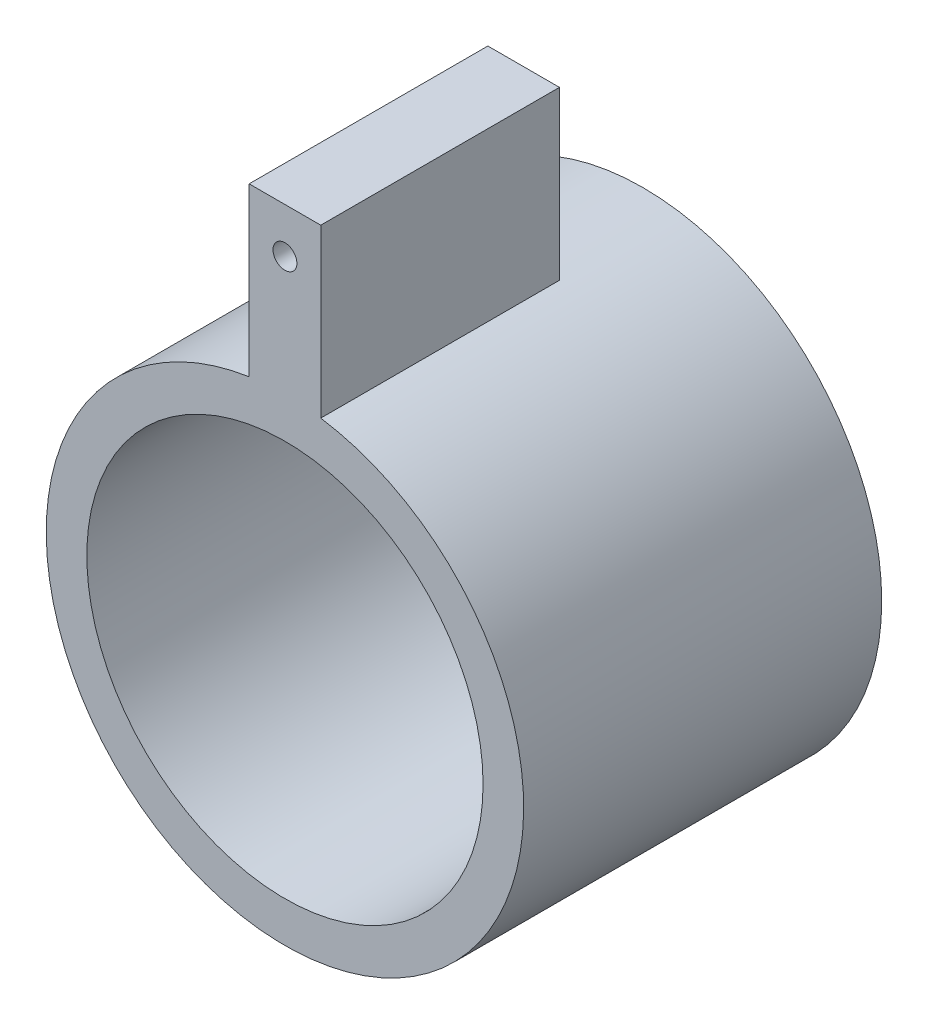
from build123d import *

# Parameters (mm, degrees)
SKETCH5_R           = 10
SKETCH5_R_2         = 8.3
BOSS_EXTRUDE1_DEPTH = 15
SKETCH6_R           = 10
BOSS_EXTRUDE2_DEPTH = 2
SKETCH7_W           = 3
SKETCH7_H           = 7
SKETCH7_R           = 0.5
BOSS_EXTRUDE3_DEPTH = 10


with BuildPart() as part:
    # Sketch5 → Boss-Extrude1 (new body)
    with BuildSketch(Plane.XY):
        Circle(SKETCH5_R)
        Circle(SKETCH5_R_2, mode=Mode.SUBTRACT)
    extrude(amount=BOSS_EXTRUDE1_DEPTH)

    # Sketch6 → Boss-Extrude2 (add)
    with BuildSketch(Plane.XY):
        Circle(SKETCH6_R)
    extrude(amount=BOSS_EXTRUDE2_DEPTH)

    # Sketch7 → Boss-Extrude3 (add)
    with BuildSketch(Plane.XY.offset(15)):
        with Locations((0, 13.386859967)):
            Rectangle(SKETCH7_W, SKETCH7_H)
        with Locations((0, 15)):
            Circle(SKETCH7_R, mode=Mode.SUBTRACT)
    extrude(amount=-BOSS_EXTRUDE3_DEPTH)


solid = part.part
